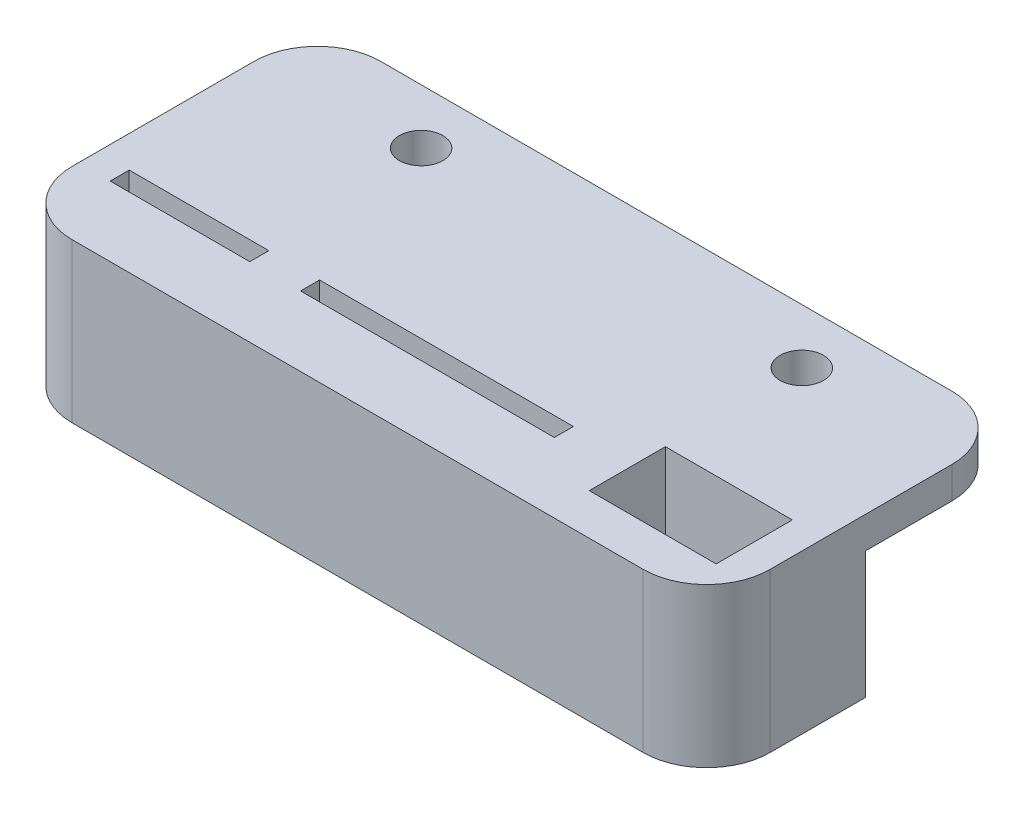
from build123d import *

# Parameters (mm, degrees)
SKETCH1_W           = 110
SKETCH1_H           = 30
BOSS_EXTRUDE1_DEPTH = 5
SKETCH2_W           = 110
SKETCH2_H           = 25
BOSS_EXTRUDE2_DEPTH = 25
SKETCH6_R           = 3.429
CUT_EXTRUDE4_DEPTH  = 73.456883731
SKETCH7_W           = 40
SKETCH7_H           = 3
SKETCH7_W_2         = 20
SKETCH7_H_2         = 12
SKETCH7_W_3         = 22
CUT_EXTRUDE5_DEPTH  = 73.456883731
SKETCH8_W           = 110
SKETCH8_H           = 6.35
CUT_EXTRUDE6_DEPTH  = 73.456883731
FILLET1_R           = 10


with BuildPart() as part:
    # Sketch1 → Boss-Extrude1 (new body)
    with BuildSketch(Plane(origin=(0, 0, 0), x_dir=(1, 0, 0), z_dir=(0, 1, 0))):
        Rectangle(SKETCH1_W, SKETCH1_H)
    extrude(amount=BOSS_EXTRUDE1_DEPTH)

    # Sketch2 → Boss-Extrude2 (add)
    with BuildSketch(Plane.XY.offset(15)):
        with Locations((0, -7.5)):
            Rectangle(SKETCH2_W, SKETCH2_H)
    extrude(amount=BOSS_EXTRUDE2_DEPTH)

    # Sketch6 → Cut-Extrude4 (cut, through all)
    with BuildSketch(Plane(origin=(0, 5, 0), x_dir=(1, 0, 0), z_dir=(0, 1, 0))):
        with Locations(Location((-30, 0, 0), (0, 0, 270))):
            Circle(SKETCH6_R)
        with Locations(Location((30, 0, 0), (0, 0, 270))):
            Circle(SKETCH6_R)
    extrude(amount=-CUT_EXTRUDE4_DEPTH, mode=Mode.SUBTRACT)

    # Sketch7 → Cut-Extrude5 (cut, through all)
    with BuildSketch(Plane(origin=(0, 5, 0), x_dir=(1, 0, 0), z_dir=(0, 1, 0))):
        with Locations((0, -27.5)):
            Rectangle(SKETCH7_W, SKETCH7_H)
        with Locations((40, -27.5)):
            Rectangle(SKETCH7_W_2, SKETCH7_H_2)
        with Locations((-39, -27.5)):
            Rectangle(SKETCH7_W_3, SKETCH7_H)
    extrude(amount=-CUT_EXTRUDE5_DEPTH, mode=Mode.SUBTRACT)

    # Sketch8 → Cut-Extrude6 (cut, through all)
    with BuildSketch(Plane(origin=(0, 5, 0), x_dir=(1, 0, 0), z_dir=(0, 1, 0))):
        with Locations((0, 11.825)):
            Rectangle(SKETCH8_W, SKETCH8_H)
    extrude(amount=-CUT_EXTRUDE6_DEPTH, mode=Mode.SUBTRACT)

    # Fillet1
    fillet1_edges = [part.edges().sort_by_distance(p)[0] for p in [
        (-55, -7.5, 40),
        (55, -7.5, 40),
        (-55, 2.5, -8.65),
        (55, 2.5, -8.65),
    ]]
    fillet(fillet1_edges, radius=FILLET1_R)


solid = part.part
